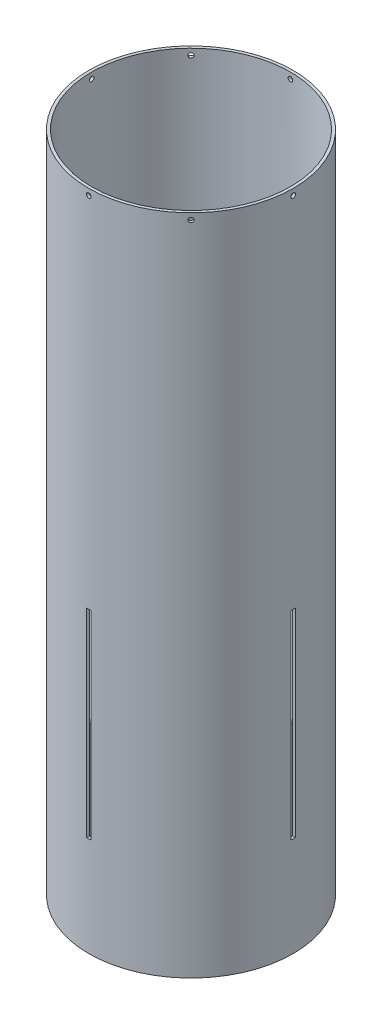
from build123d import *

# Parameters (mm, degrees)
SKETCH1_R           = 78.359
SKETCH1_R_2         = 76.2
BOSS_EXTRUDE1_DEPTH = 508
CUT_EXTRUDE1_DEPTH  = 520.946406625
CIRPATTERN1_COUNT   = 4
CUT_EXTRUDE2_DEPTH  = 520.946406625
CIRPATTERN2_COUNT   = 8


with BuildPart() as part:
    # Sketch1 → Boss-Extrude1 (new body)
    with BuildSketch(Plane(origin=(0, 0, 0), x_dir=(1, 0, 0), z_dir=(0, 1, 0))):
        Circle(SKETCH1_R)
        Circle(SKETCH1_R_2, mode=Mode.SUBTRACT)
    extrude(amount=BOSS_EXTRUDE1_DEPTH)

    # Sketch2 → Cut-Extrude1 (cut, through all)
    with BuildSketch(Plane(origin=(0, 0, 0), x_dir=(0, 0, -1), z_dir=(1, 0, 0))):
        Polygon((0, 76.2), (1.5875, 76.2), (1.5875, 228.6), (-1.5875, 228.6), (-1.5875, 76.2), align=None)
    cut_extrude1 = extrude(amount=-CUT_EXTRUDE1_DEPTH, mode=Mode.SUBTRACT)

    # CirPattern1: Cut-Extrude1 ×4 about axis
    cirpattern1_axis = Axis((0, 0, 0), (0, 1, 0))
    for i in range(1, CIRPATTERN1_COUNT):
        add(cut_extrude1.rotate(cirpattern1_axis, i * 360 / CIRPATTERN1_COUNT), mode=Mode.SUBTRACT)

    # Sketch2<3> → Cut-Extrude2 (cut, through all)
    with BuildSketch(Plane(origin=(0, 0, 0), x_dir=(0, 0, -1), z_dir=(1, 0, 0))):
        with BuildLine():
            ThreePointArc((0, 504.987500056), (-1.237436907, 502.000063093), (1.750000056, 503.2375))
            ThreePointArc((1.750000056, 503.2375), (1.237436907, 504.474936907), (0, 504.987500056))
        make_face()
    cut_extrude2 = extrude(amount=-CUT_EXTRUDE2_DEPTH, mode=Mode.SUBTRACT)

    # CirPattern2: Cut-Extrude2 ×8 about axis
    cirpattern2_axis = Axis((0, 508, 0), (0, -1, 0))
    for i in range(1, CIRPATTERN2_COUNT):
        add(cut_extrude2.rotate(cirpattern2_axis, i * 360 / CIRPATTERN2_COUNT), mode=Mode.SUBTRACT)


solid = part.part
